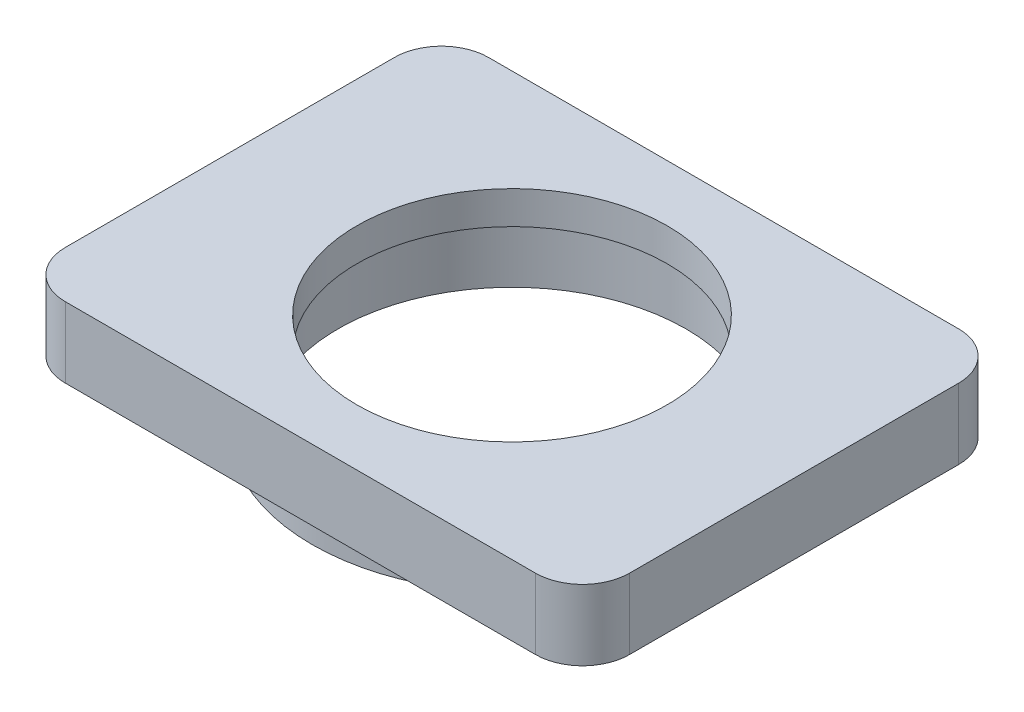
from build123d import *

# Parameters (mm, degrees)
SKETCH1_R           = 21.25
SKETCH1_R_2         = 18.5
BOSS_EXTRUDE1_DEPTH = 8
SKETCH2_R           = 22.5
SKETCH2_R_2         = 16.5
BOSS_EXTRUDE2_DEPTH = 2.5
BOSS_EXTRUDE3_START = -7.5
SKETCH3_W           = 60
SKETCH3_H           = 45
SKETCH3_R           = 16.5
BOSS_EXTRUDE3_DEPTH = 7.5
FILLET2_R           = 5
SKETCH4_R           = 18.5
CUT_EXTRUDE1_DEPTH  = 4
SKETCH5_R           = 1.75
CUT_EXTRUDE2_DEPTH  = 6.2


with BuildPart() as part:
    # Sketch1 → Boss-Extrude1 (new body)
    with BuildSketch(Plane(origin=(0, 0, 0), x_dir=(1, 0, 0), z_dir=(0, 1, 0))):
        with Locations(Location((0, 0, 0), (0, 0, 270))):
            Circle(SKETCH1_R)
        with Locations(Location((0, 0, 0), (0, 0, 270))):
            Circle(SKETCH1_R_2, mode=Mode.SUBTRACT)
    extrude(amount=BOSS_EXTRUDE1_DEPTH)

    # Sketch2 → Boss-Extrude2 (add)
    with BuildSketch(Plane(origin=(0, 8, 0), x_dir=(1, 0, 0), z_dir=(0, 1, 0))):
        with Locations(Location((0, 0, 0), (0, 0, 270))):
            Circle(SKETCH2_R)
        with Locations(Location((0, 0, 0), (0, 0, 270))):
            Circle(SKETCH2_R_2, mode=Mode.SUBTRACT)
    extrude(amount=BOSS_EXTRUDE2_DEPTH)

    # Sketch3 → Boss-Extrude3 (add)
    with BuildSketch(Plane(origin=(0, 10.5, 0), x_dir=(1, 0, 0), z_dir=(0, 1, 0)).offset(BOSS_EXTRUDE3_START)):
        Rectangle(SKETCH3_W, SKETCH3_H)
        with Locations(Location((0, 0, 0), (0, 0, 270))):
            Circle(SKETCH3_R, mode=Mode.SUBTRACT)
    extrude(amount=BOSS_EXTRUDE3_DEPTH)

    # Fillet2
    fillet2_edges = [part.edges().sort_by_distance(p)[0] for p in [
        (30, 6.75, -22.5),
        (30, 6.75, 22.5),
        (-30, 6.75, 22.5),
        (-30, 6.75, -22.5),
    ]]
    fillet(fillet2_edges, radius=FILLET2_R)

    # Sketch4 → Cut-Extrude1 (cut)
    with BuildSketch(Plane(origin=(0, 3, 0), x_dir=(-1, 0, 0), z_dir=(0, -1, 0))):
        with Locations(Location((0, 0, 0), (0, 0, 90))):
            Circle(SKETCH4_R)
    extrude(amount=-CUT_EXTRUDE1_DEPTH, mode=Mode.SUBTRACT)

    # Sketch5 → Cut-Extrude2 (cut)
    with BuildSketch(Plane(origin=(0, 3, 0), x_dir=(-1, 0, 0), z_dir=(0, -1, 0))):
        with Locations(Location((25, -17.5, 0), (0, 0, 90))):
            Circle(SKETCH5_R)
        with Locations(Location((-25, -17.5, 0), (0, 0, 90))):
            Circle(SKETCH5_R)
        with Locations(Location((-25, 17.5, 0), (0, 0, 90))):
            Circle(SKETCH5_R)
        with Locations(Location((25, 17.5, 0), (0, 0, 90))):
            Circle(SKETCH5_R)
    extrude(amount=-CUT_EXTRUDE2_DEPTH, mode=Mode.SUBTRACT)


solid = part.part
